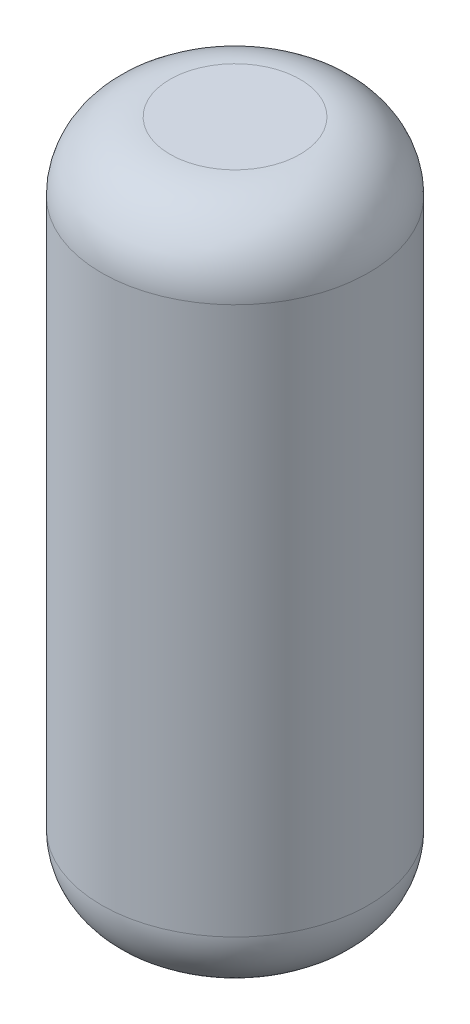
from build123d import *

# Parameters (mm, degrees)
ESQUISSE1_R        = 1.95
BOSS_EXTRU_1_DEPTH = 10
CONG_1_R           = 1


with BuildPart() as part:
    # Esquisse1 → Boss.-Extru.1 (new body)
    with BuildSketch(Plane(origin=(0, 0, 0), x_dir=(1, 0, 0), z_dir=(0, 1, 0))):
        with Locations(Location((0, 0, 0), (0, 0, 270))):
            Circle(ESQUISSE1_R)
    extrude(amount=BOSS_EXTRU_1_DEPTH)

    # Congé1
    cong_1_edges = [part.edges().sort_by_distance(p)[0] for p in [
        (0, 0, -1.95),
        (0, 10, -1.95),
    ]]
    fillet(cong_1_edges, radius=CONG_1_R)


solid = part.part
